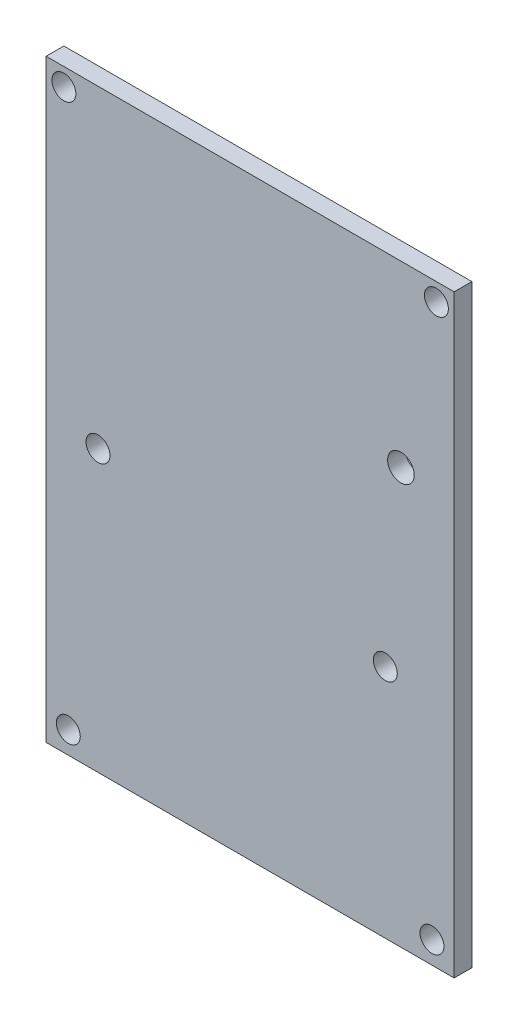
from build123d import *

# Parameters (mm, degrees)
SKETCH1_W                  = 46
SKETCH1_H                  = 67
BOSS_EXTRUDE1_DEPTH        = 2
F_2_7_2_7_DIAMETER_HOLE1_D = 2.7
F_3_0_3_DIAMETER_HOLE1_D   = 3


with BuildPart() as part:
    # Sketch1 → Boss-Extrude1 (new body)
    with BuildSketch(Plane.XY):
        Rectangle(SKETCH1_W, SKETCH1_H)
    extrude(amount=BOSS_EXTRUDE1_DEPTH)

    # Ø2.7 (2.7) Diameter Hole1 (through all)
    with Locations(Plane.XY.offset(2)):
        with Locations((-21, 31.5), (21, 31.5), (20.5, -31), (-20.5, -31), (-17.155, -1.895), (15.24, -6.985)):
            Hole(F_2_7_2_7_DIAMETER_HOLE1_D / 2)

    # Ø3.0 (3) Diameter Hole1 (through all)
    with Locations(Plane.XY.offset(2)):
        with Locations((17, 13.345)):
            Hole(F_3_0_3_DIAMETER_HOLE1_D / 2)


solid = part.part
